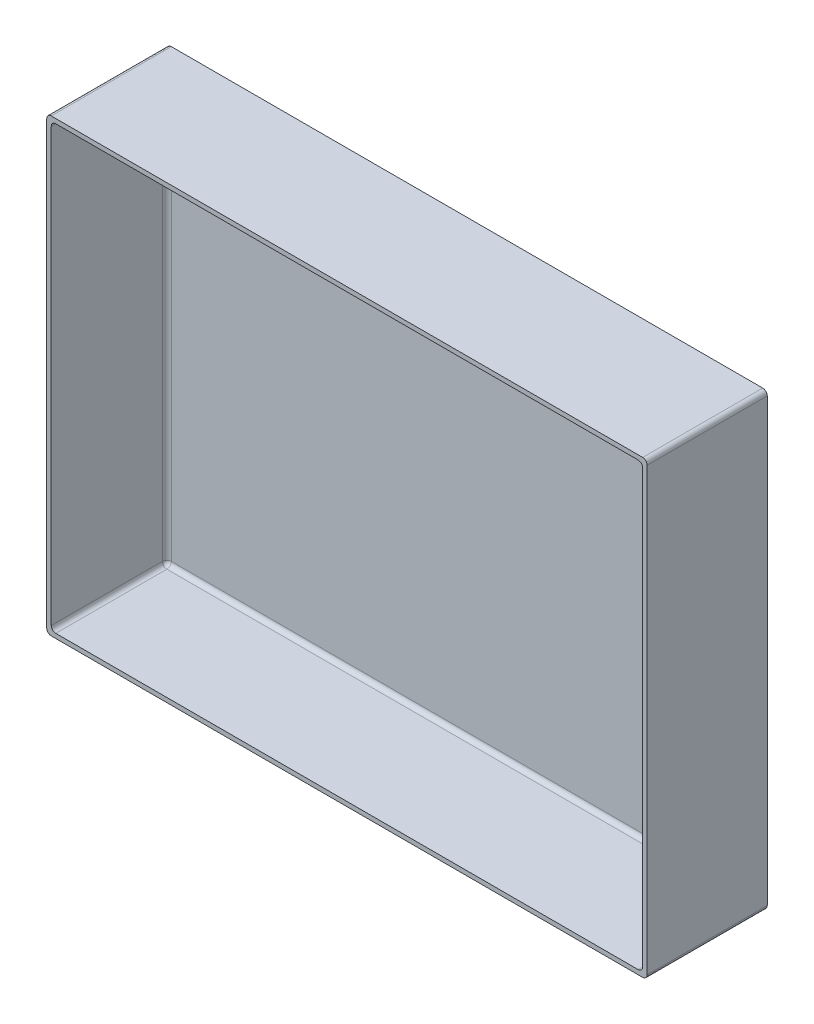
from build123d import *

# Parameters (mm, degrees)
SKETCH_1_W      = 400
SKETCH_1_H      = 300
EXTRUDE_1_DEPTH = 80
SHELL_1_T       = -3
FILLET_1_R      = 3
FILLET_2_R      = 3


with BuildPart() as part:
    # 草图1 → 凸台-拉伸1 (new body)
    with BuildSketch(Plane.XY):
        Rectangle(SKETCH_1_W, SKETCH_1_H)
    extrude(amount=EXTRUDE_1_DEPTH)

    # 抽壳1
    shell_1_openings = [part.faces().sort_by_distance(p)[0] for p in [
        (0, 0, 80),
    ]]
    offset(amount=SHELL_1_T, openings=shell_1_openings, kind=Kind.INTERSECTION)

    # 圆角1
    fillet_1_edges = [part.edges().sort_by_distance(p)[0] for p in [
        (197, 0, 3),
        (197, -147, 41.5),
        (0, 147, 3),
        (197, 147, 41.5),
        (-197, 0, 3),
        (-197, 147, 41.5),
        (0, -147, 3),
        (-197, -147, 41.5),
    ]]
    fillet(fillet_1_edges, radius=FILLET_1_R)

    # 圆角2
    fillet_2_edges = [part.edges().sort_by_distance(p)[0] for p in [
        (200, -150, 40),
        (-200, -150, 40),
        (-200, 150, 40),
        (200, 150, 40),
    ]]
    fillet(fillet_2_edges, radius=FILLET_2_R)


solid = part.part
